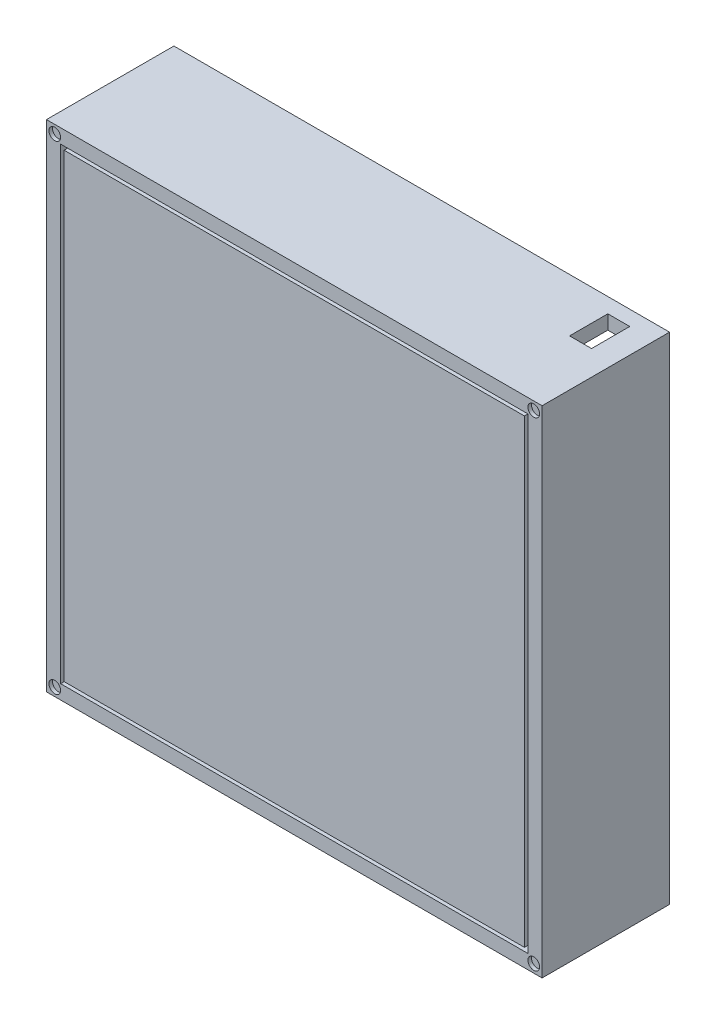
from build123d import *

# Parameters (mm, degrees)
SKETCH5_W           = 130
SKETCH5_H           = 130
BOSS_EXTRUDE4_DEPTH = 10
SKETCH6_W           = 140
SKETCH6_H           = 140
SKETCH6_W_2         = 132
SKETCH6_H_2         = 132
BOSS_EXTRUDE5_DEPTH = 36
SKETCH7_R           = 1.651
CUT_EXTRUDE2_DEPTH  = 1.02
SKETCH8_W           = 13
SKETCH8_H           = 27.8
CUT_EXTRUDE3_DEPTH  = 4
SKETCH9_W           = 6.2
SKETCH9_H           = 10.8
CUT_EXTRUDE4_DEPTH  = 10


with BuildPart() as part:
    # Sketch5 → Boss-Extrude4 (new body)
    with BuildSketch(Plane.XY):
        Rectangle(SKETCH5_W, SKETCH5_H)
    extrude(amount=BOSS_EXTRUDE4_DEPTH)


with BuildPart() as body_2:
    # Sketch6 → Boss-Extrude5 (new body)
    with BuildSketch(Plane.XY.offset(10)):
        Rectangle(SKETCH6_W, SKETCH6_H)
        Rectangle(SKETCH6_W_2, SKETCH6_H_2, mode=Mode.SUBTRACT)
    extrude(amount=-BOSS_EXTRUDE5_DEPTH)

    # Sketch7 → Cut-Extrude2 (cut)
    with BuildSketch(Plane.XY.offset(10)):
        with Locations((67.651, 67.651)):
            Circle(SKETCH7_R)
        with Locations(Location((-67.651, 67.651, 0), (0, 0, 180))):
            Circle(SKETCH7_R)
        with Locations(Location((67.651, -67.651, 0), (0, 0, 180))):
            Circle(SKETCH7_R)
        with Locations((-67.651, -67.651)):
            Circle(SKETCH7_R)
    extrude(amount=-CUT_EXTRUDE2_DEPTH, mode=Mode.SUBTRACT)

    # Sketch8 → Cut-Extrude3 (cut)
    with BuildSketch(Plane.XZ.offset(70)):
        with Locations((-52.5, -12.1)):
            Rectangle(SKETCH8_W, SKETCH8_H)
        with Locations((52.5, -12.1)):
            Rectangle(SKETCH8_W, SKETCH8_H)
    extrude(amount=-CUT_EXTRUDE3_DEPTH, mode=Mode.SUBTRACT)

    # Sketch9 → Cut-Extrude4 (cut)
    with BuildSketch(Plane(origin=(0, 70, 0), x_dir=(1, 0, 0), z_dir=(0, 1, 0))):
        with Locations((59.9, 16.368072475)):
            Rectangle(SKETCH9_W, SKETCH9_H)
    extrude(amount=-CUT_EXTRUDE4_DEPTH, mode=Mode.SUBTRACT)


solid = Compound([part.part, body_2.part])
